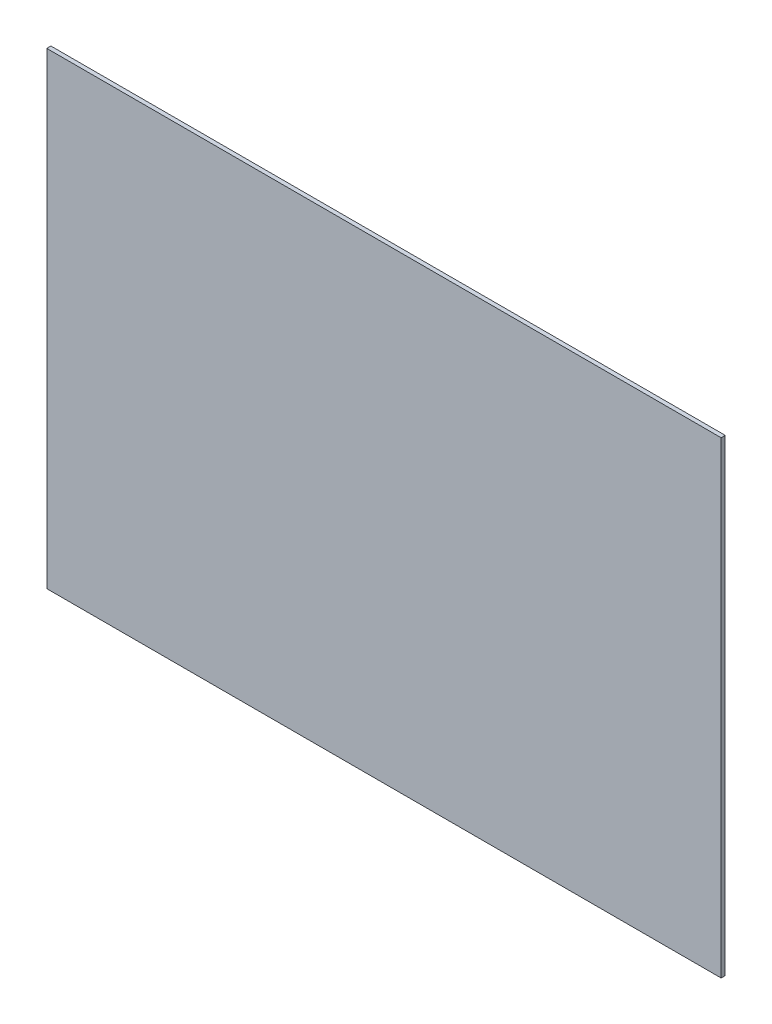
from build123d import *

# Parameters (mm, degrees)
ESQUISSE1_W      = 49
ESQUISSE1_H      = 34
EXTRUSION1_DEPTH = 0.3


with BuildPart() as part:
    # Esquisse1 → Extrusion1 (new body)
    with BuildSketch(Plane.XY):
        with Locations((-7.576571429, -9.216428571)):
            Rectangle(ESQUISSE1_W, ESQUISSE1_H)
    extrude(amount=-EXTRUSION1_DEPTH)


solid = part.part
